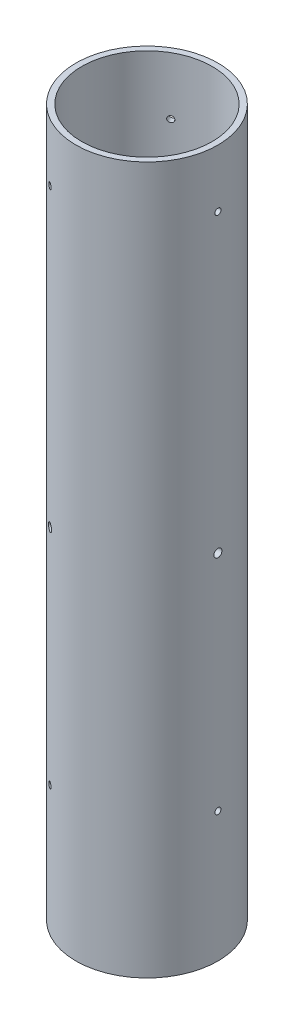
from build123d import *

# Parameters (mm, degrees)
SKETCH1_R                             = 41.656
SKETCH1_R_2                           = 38.227
BOSS_EXTRUDE1_DEPTH                   = 414.3375
CUT_EXTRUDE1_REACH                    = 428.171
CUT_EXTRUDE1_END_RADIUS               = 38.227
SKETCH2_R                             = 1.778
CIRPATTERN1_COUNT                     = 3
PRESSURE_EQUALIZATION_HOLE_REACH      = 428.171
PRESSURE_EQUALIZATION_HOLE_END_RADIUS = 38.227
SKETCH3_R                             = 2.38125
CIRPATTERN2_COUNT                     = 3
CUT_EXTRUDE3_REACH                    = 426.678
CUT_EXTRUDE3_END_RADIUS               = 38.227
SKETCH4_R                             = 1.7859375
CIRPATTERN3_COUNT                     = 3


with BuildPart() as part:
    # Sketch1 → Boss-Extrude1 (new body)
    with BuildSketch(Plane(origin=(0, 0, 0), x_dir=(1, 0, 0), z_dir=(0, 1, 0))):
        with Locations(Location((0, 0, 0), (0, 0, 270))):
            Circle(SKETCH1_R)
        with Locations(Location((0, 0, 0), (0, 0, 270))):
            Circle(SKETCH1_R_2, mode=Mode.SUBTRACT)
    extrude(amount=BOSS_EXTRUDE1_DEPTH)

    # Cut-Extrude1: up to this cylinder (the profile starts outside it)
    cut_extrude1_end = Plane(origin=(0, 76.2, 0), z_dir=(0, -1, 0)) * Cylinder(CUT_EXTRUDE1_END_RADIUS, 933.796, mode=Mode.PRIVATE)
    # Sketch2 → Cut-Extrude1 (cut, up to the surface)
    with BuildSketch(Plane(origin=(-20.828, 0, 36.07515422), x_dir=(0, -1, 0), z_dir=(-0.499999999999998, 0, 0.8660254037844398)), mode=Mode.PRIVATE) as cut_extrude1_sk1:
        with Locations(Location((-76.2, 0, 0), (0, 0, 90))):
            Circle(SKETCH2_R)
    cut_extrude1_tool1 = extrude(cut_extrude1_sk1.sketch, amount=-CUT_EXTRUDE1_REACH, mode=Mode.PRIVATE) - cut_extrude1_end
    cut_extrude1 = cut_extrude1_tool1.solids().sort_by_distance((-20.828, 76.2, 36.075154))[0]
    add(cut_extrude1, mode=Mode.SUBTRACT)

    # CirPattern1: Cut-Extrude1 ×3 about axis
    cirpattern1_axis = Axis((0, -7.62, 0), (0, 1, 0))
    for i in range(1, CIRPATTERN1_COUNT):
        add(cut_extrude1.rotate(cirpattern1_axis, i * 360 / CIRPATTERN1_COUNT), mode=Mode.SUBTRACT)

    # Pressure Equalization Hole: up to this cylinder (the profile starts outside it)
    pressure_equalization_hole_end = Plane(origin=(0, 207.16875, 0), z_dir=(0, -1, 0)) * Cylinder(PRESSURE_EQUALIZATION_HOLE_END_RADIUS, 933.796, mode=Mode.PRIVATE)
    # Sketch3 → Pressure Equalization Hole (cut, up to the surface)
    with BuildSketch(Plane(origin=(-20.828, 0, 36.07515422), x_dir=(0, -1, 0), z_dir=(-0.499999999999998, 0, 0.8660254037844398)), mode=Mode.PRIVATE) as pressure_equalization_hole_sk1:
        with Locations(Location((-207.16875, 0, 0), (0, 0, 90))):
            Circle(SKETCH3_R)
    pressure_equalization_hole_tool1 = extrude(pressure_equalization_hole_sk1.sketch, amount=-PRESSURE_EQUALIZATION_HOLE_REACH, mode=Mode.PRIVATE) - pressure_equalization_hole_end
    pressure_equalization_hole = pressure_equalization_hole_tool1.solids().sort_by_distance((-20.828, 207.16875, 36.075154))[0]
    add(pressure_equalization_hole, mode=Mode.SUBTRACT)

    # CirPattern2: Pressure Equalization Hole ×3 about axis
    cirpattern2_axis = Axis((0, -7.62, 0), (0, 1, 0))
    for i in range(1, CIRPATTERN2_COUNT):
        add(pressure_equalization_hole.rotate(cirpattern2_axis, i * 360 / CIRPATTERN2_COUNT), mode=Mode.SUBTRACT)

    # Cut-Extrude3: up to this cylinder (the profile starts outside it)
    cut_extrude3_end = Plane(origin=(0, 380.5301, 0), z_dir=(0, -1, 0)) * Cylinder(CUT_EXTRUDE3_END_RADIUS, 930.81, mode=Mode.PRIVATE)
    # Sketch4 → Cut-Extrude3 (cut, up to the surface)
    with BuildSketch(Plane(origin=(41.656, 0, 0), x_dir=(0, -1, 0), z_dir=(-1, 0, 0)), mode=Mode.PRIVATE) as cut_extrude3_sk1:
        with Locations(Location((-380.5301, 0, 0), (0, 0, 270))):
            Circle(SKETCH4_R)
    cut_extrude3_tool1 = extrude(cut_extrude3_sk1.sketch, amount=CUT_EXTRUDE3_REACH, mode=Mode.PRIVATE) - cut_extrude3_end
    cut_extrude3 = cut_extrude3_tool1.solids().sort_by_distance((41.656, 380.5301, 0))[0]
    add(cut_extrude3, mode=Mode.SUBTRACT)

    # CirPattern3: Cut-Extrude3 ×3 about axis
    cirpattern3_axis = Axis((0, -7.62, 0), (0, 1, 0))
    for i in range(1, CIRPATTERN3_COUNT):
        add(cut_extrude3.rotate(cirpattern3_axis, i * 360 / CIRPATTERN3_COUNT), mode=Mode.SUBTRACT)


solid = part.part
